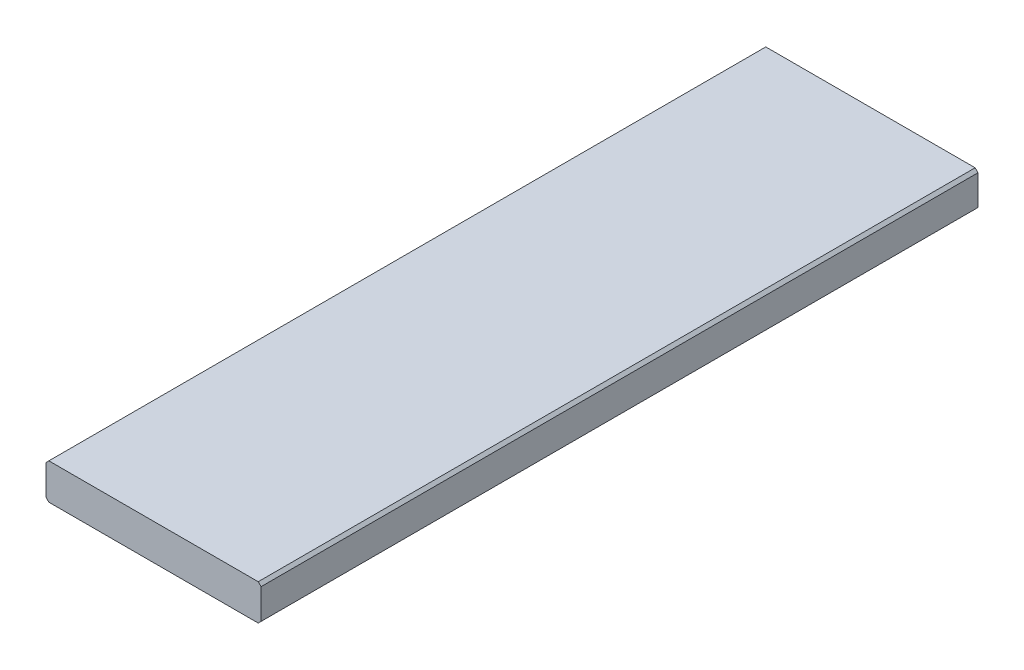
from build123d import *

# Parameters (mm, degrees)
EXTRUDE_1_DEPTH = 500


with BuildPart() as part:
    # Эскиз1 → Бобышка-Вытянуть1 (new body)
    with BuildSketch(Plane.XY):
        Polygon((-75, 10.5), (-73, 12.5), (73, 12.5), (75, 10.5), (75, -10.5), (73, -12.5), (-73, -12.5), (-75, -10.5), align=None)
    extrude(amount=EXTRUDE_1_DEPTH)


solid = part.part
